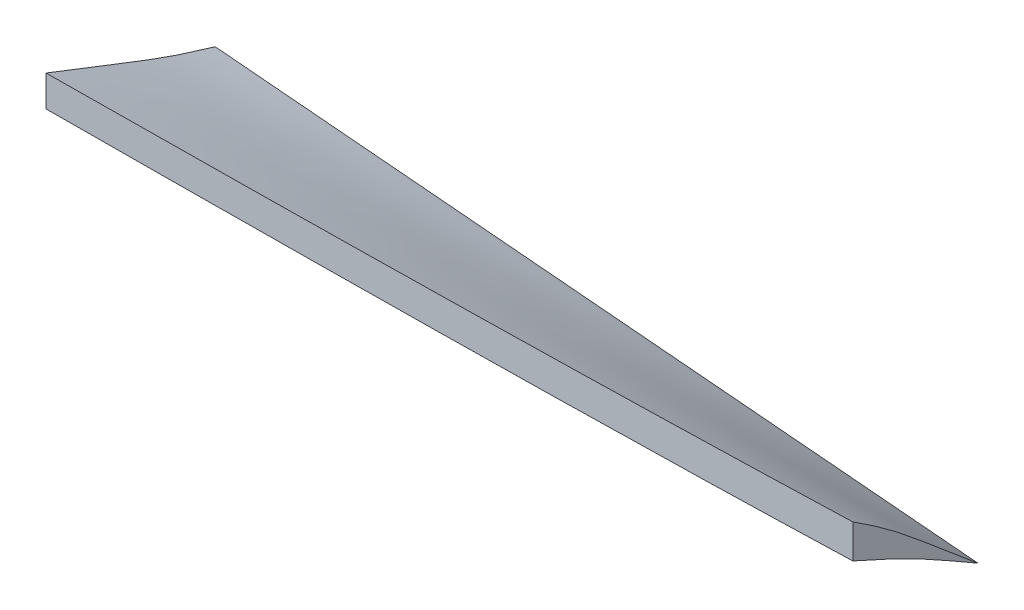
from build123d import *

# Parameters (mm, degrees)
CUT_EXTRUDE1_DEPTH      = 891.721444301
CUT_EXTRUDE1_DEPTH_BACK = 891.721444301


with BuildPart() as part:
    # Sketch1 → Loft1 section 0
    with BuildSketch(Plane(origin=(266.7, 0, 0), x_dir=(0, 0, -1), z_dir=(1, 0, 0))):
        with BuildLine():
            add(Edge.make_bspline(
                [(0, 0), (0.017452033, -0.519005663), (0.06166203, -1.833765907), (0.570189515, -4.396811557), (2.53612962, -10.616386462), (7.9982118, -20.550135555), (16.1136536, -34.184951823), (25.751267724, -48.900160958), (36.932012921, -62.938772264), (49.33636939, -75.918564931), (65.226906539, -85.624987008), (84.452765046, -91.717357185), (106.852134498, -96.151510734), (132.510932076, -98.572249175), (161.194365788, -99.092382868), (192.761343292, -97.704243711), (227.038217577, -94.511839296), (263.834756502, -89.663828122), (302.921473177, -83.388445028), (344.017776041, -75.977786804), (386.776799789, -67.780707382), (430.77461487, -59.202323955), (475.496263681, -50.66380512), (520.335279967, -42.603612471), (564.588870456, -35.422796347), (607.4709344, -29.473308084), (648.127538759, -25.014473383), (685.667615873, -22.186241782), (719.196759596, -21.00476141), (747.830287498, -21.278636312), (770.688405743, -22.854711922), (787.091395164, -25.07351564), (796.842303095, -26.819328187), (801.097715575, -27.775140745), (802.151053399, -28.011732033)],
                knots=[0, 0, 0, 0, 0.001820909, 0.00461278, 0.00913453, 0.024675939, 0.044152768, 0.064937103, 0.086320988, 0.107137618, 0.127599777, 0.150892793, 0.177565203, 0.207667777, 0.241222088, 0.278203414, 0.318526303, 0.362030579, 0.408464625, 0.457479062, 0.508614437, 0.561296015, 0.614835295, 0.668437534, 0.721214466, 0.772202341, 0.820393483, 0.864765923, 0.904323704, 0.938131581, 0.965241743, 0.984690447, 0.996210442, 1, 1, 1, 1], degree=3))
            add(Edge.make_bspline(
                [(802.151053399, -28.011732033), (801.137231832, -27.710542123), (797.278434829, -26.564156251), (789.357225956, -23.458600593), (777.06146068, -18.643579076), (760.581722214, -13.040064966), (739.99675031, -7.1233282), (715.577161881, -0.379813283), (687.646997389, 7.013021798), (656.683490083, 14.958443735), (623.15891656, 23.258345049), (587.549187868, 31.694376174), (550.31922689, 40.026159278), (511.914813655, 48.001625947), (472.761711337, 55.374538475), (433.262164148, 61.912775617), (393.795881302, 67.404801186), (354.719946084, 71.655180259), (316.356950184, 74.535698451), (278.931254814, 75.753587714), (242.69940893, 75.393823286), (207.870582877, 73.546655951), (174.746776105, 70.258980652), (143.601377813, 65.76818338), (114.762118239, 60.187460639), (88.534490153, 53.628471164), (65.198980042, 46.238223105), (45.000589803, 38.13387291), (28.158616929, 29.509232905), (14.871033111, 20.557827015), (6.144191432, 12.313264357), (1.948102578, 6.176486601), (0.639134364, 3.084122633), (0.217045478, 1.668030347), (0.042563089, 0.777840261), (0.010742005, 0.196310087), (0, 0)],
                knots=[0, 0, 0, 0, 0.003802345, 0.014472446, 0.030563625, 0.051299059, 0.07702847, 0.107573811, 0.142399413, 0.180921149, 0.22252468, 0.266590974, 0.312514686, 0.359710118, 0.407632337, 0.455773217, 0.503669018, 0.550900956, 0.597096183, 0.641976048, 0.685511898, 0.727353252, 0.767353583, 0.805169064, 0.840471252, 0.872937278, 0.902335209, 0.928425323, 0.951113046, 0.970252676, 0.985871491, 0.993981784, 0.996752649, 0.997906779, 0.999293381, 1, 1, 1, 1], degree=3))
        make_face()
    # Sketch2 → Loft1 section 1
    with BuildSketch(Plane(origin=(374.396, 0, 0), x_dir=(0, 0, -1), z_dir=(1, 0, 0))):
        with BuildLine():
            add(Edge.make_bspline(
                [(241.3, 0), (241.297655185, -0.53895466), (241.292490042, -1.726160333), (241.690170496, -3.554756901), (242.787647349, -5.285750443), (244.559100968, -6.478197036), (246.693492664, -7.234399617), (249.13102664, -7.749349513), (251.905250666, -8.109552457), (255.097825264, -8.365361309), (258.834169307, -8.539277754), (263.297687326, -8.62282221), (268.751433245, -8.598454119), (275.5550069, -8.430434414), (284.115477039, -8.068973839), (294.701993417, -7.467296112), (307.238662481, -6.565509351), (321.351176792, -5.267746603), (336.635216145, -3.498612117), (352.842840734, -1.31741886), (369.808726727, 1.121625696), (387.306924799, 3.704841508), (405.053096078, 6.350855724), (422.799408726, 8.98235684), (440.376908078, 11.530022791), (457.707871032, 13.943001068), (474.772580756, 16.172906662), (491.576454149, 18.185283163), (508.136887078, 19.944519492), (524.480515327, 21.422853165), (540.633952092, 22.600664832), (556.62591669, 23.45702203), (572.479352869, 23.981185901), (588.217968125, 24.158904157), (603.859249006, 23.982843705), (619.418444987, 23.445613), (634.897947787, 22.545522915), (650.289014071, 21.280364951), (665.556610194, 19.655496457), (680.627419738, 17.677015917), (695.363311814, 15.374920464), (709.53869208, 12.782897075), (722.850908635, 9.970758518), (734.983994697, 7.012558215), (745.710637795, 3.966527935), (754.965559993, 0.871097223), (762.812999366, -2.267646124), (769.870558631, -5.550908071), (774.178423342, -8.05223933), (776.396489798, -9.340143972)],
                knots=[0, 0, 0, 0, 0.002956996, 0.00651365, 0.010125385, 0.013911575, 0.018000428, 0.022509132, 0.027570198, 0.033355256, 0.040093935, 0.04810894, 0.057869876, 0.070043142, 0.08548232, 0.104922628, 0.128274622, 0.15450638, 0.182746709, 0.212765693, 0.244315985, 0.276878379, 0.309904596, 0.342852711, 0.375404074, 0.407445979, 0.438949076, 0.46991622, 0.500387508, 0.530404995, 0.560035324, 0.589330242, 0.618350498, 0.64714112, 0.675762771, 0.704247977, 0.732632991, 0.760909446, 0.789050397, 0.816945539, 0.844377955, 0.870950737, 0.896076017, 0.919089977, 0.939522088, 0.957298391, 0.972656028, 0.985920926, 1, 1, 1, 1], degree=3))
            add(Edge.make_bspline(
                [(776.396489798, -9.340143972), (775.264229702, -8.401754843), (772.482179212, -6.096060289), (768.02376491, -2.179435062), (762.218322929, 1.848598359), (755.243229686, 5.600344911), (746.912760701, 9.335471689), (737.018252872, 13.238608907), (725.478678298, 17.316182183), (712.428375503, 21.511581953), (698.167711363, 25.742123335), (683.062552056, 29.924039537), (667.444717495, 33.98191971), (651.563094479, 37.85878072), (635.571677799, 41.50756827), (619.542134961, 44.896204556), (603.480438345, 48.006262968), (587.348007897, 50.838453128), (571.079262558, 53.403726763), (554.597347915, 55.729750545), (537.831743695, 57.85187895), (520.741731841, 59.820394331), (503.340217598, 61.685647383), (485.710728793, 63.489925988), (468.011203684, 65.249891359), (450.459510763, 66.951772198), (433.311455419, 68.537866027), (416.841536857, 69.928915106), (401.296477174, 71.032768307), (386.808729153, 71.72962729), (373.351309187, 71.893808625), (360.783321416, 71.460297851), (348.941977506, 70.418471993), (337.701052478, 68.763422594), (326.980618986, 66.498526744), (316.739864215, 63.636475775), (306.973125092, 60.206334855), (297.713837698, 56.245375833), (289.029736202, 51.836604691), (281.025296442, 47.111336501), (273.817045833, 42.256369896), (267.502444449, 37.467593908), (262.111076339, 32.912011319), (257.60990674, 28.671099792), (253.911291371, 24.75953821), (250.902182399, 21.157238831), (248.463647547, 17.839519641), (246.491901816, 14.780198822), (244.907396988, 11.95061486), (243.649534234, 9.323214964), (242.679778652, 6.870618395), (241.966757378, 4.571586925), (241.49505501, 2.40963479), (241.323981846, 0.89423705), (241.302884141, 0.107544092), (241.3, 0)],
                knots=[0, 0, 0, 0, 0.007664021, 0.018831091, 0.030906188, 0.044388541, 0.060047408, 0.078460679, 0.099804721, 0.12381697, 0.149890658, 0.177317926, 0.205492409, 0.233979752, 0.262509716, 0.290967606, 0.319357501, 0.347763188, 0.376320626, 0.405182951, 0.434503841, 0.464386678, 0.494832433, 0.525708039, 0.556739737, 0.587525558, 0.61760481, 0.646485108, 0.673660143, 0.698815639, 0.722062594, 0.743776306, 0.764323118, 0.783977995, 0.802952239, 0.821385981, 0.839352414, 0.8568587, 0.873830573, 0.890070808, 0.90526801, 0.919095859, 0.931350851, 0.942034396, 0.951307872, 0.959388408, 0.966479389, 0.97275201, 0.978344066, 0.983368996, 0.987921252, 0.992076472, 0.995898894, 0.999439362, 1, 1, 1, 1], degree=3))
        make_face()
    loft()

    # Sketch3 → Cut-Extrude1 (cut, two sides: drawn at the far end of the back side and taken through both)
    with BuildSketch(Plane(origin=(0, 0, 0), x_dir=(1, 0, 0), z_dir=(0, 1, 0)).offset(-CUT_EXTRUDE1_DEPTH_BACK)):
        Polygon((230.236248948, 791.080863155), (382.175250394, 761.429175702), (382.175250394, -132.400779676), (230.236248948, -132.400779676), align=None)
    extrude(amount=CUT_EXTRUDE1_DEPTH + CUT_EXTRUDE1_DEPTH_BACK, mode=Mode.SUBTRACT)


solid = part.part
